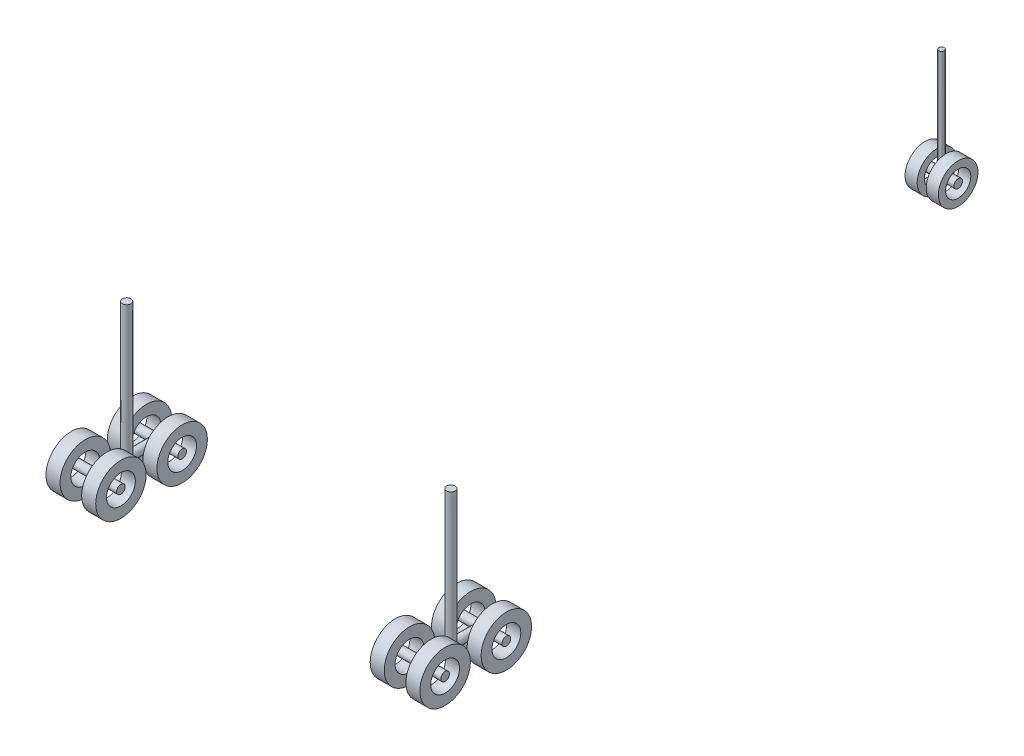
from build123d import *

# Parameters (mm, degrees)
SKETCH16_R               = 711.1999999999995
SKETCH16_R_2             = 406.3999999999997
BOSS_EXTRUDE1_DEPTH      = 396.24
BOSS_EXTRUDE1_2_DEPTH    = 396.24
SKETCH12_R               = 121.92000000000056
BOSS_EXTRUDE2_DEPTH      = 3810.0000000000005
SKETCH17_R               = 121.92000000000046
BOSS_EXTRUDE3_DEPTH      = 1402.08
SKETCH17_R_2             = 121.92000000000138
BOSS_EXTRUDE3_2_DEPTH    = 1402.08
BOSS_EXTRUDE4_DEPTH      = 762.0000000000001
BOSS_EXTRUDE4_DEPTH_BACK = 762.0000000000001
SKETCH18_R               = 121.92000000000046
SKETCH19_R               = 558.8000000000001
SKETCH19_R_2             = 355.60000000000025
BOSS_EXTRUDE5_DEPTH      = 342.9
SKETCH20_R               = 121.92000000000138
BOSS_EXTRUDE6_DEPTH      = 939.8
SKETCH21_R               = 76.20000000000083
BOSS_EXTRUDE7_DEPTH      = 3048.0000000000005


with BuildPart() as part:
    # Sketch16 → Boss-Extrude1 (new body)
    with BuildSketch(Plane(origin=(-4876.8, 0, 0), x_dir=(0, 0, -1), z_dir=(1, 0, 0))):
        with Locations((-6591.13578743189, -1.866e-14)):
            Circle(SKETCH16_R)
        with Locations((-6591.13578743189, -1.866e-14)):
            Circle(SKETCH16_R_2, mode=Mode.SUBTRACT)
    extrude(amount=-BOSS_EXTRUDE1_DEPTH)


with BuildPart() as body_2:
    # Sketch16 → Boss-Extrude1 2 (new body)
    with BuildSketch(Plane(origin=(-4876.8, 0, 0), x_dir=(0, 0, -1), z_dir=(1, 0, 0))):
        with Locations(Location((-8318.33578743189, -1.866e-14, 0), (0, 0, 180))):
            Circle(SKETCH16_R)
        with Locations(Location((-8318.33578743189, -1.866e-14, 0), (0, 0, 180))):
            Circle(SKETCH16_R_2, mode=Mode.SUBTRACT)
    extrude(amount=-BOSS_EXTRUDE1_2_DEPTH)


with BuildPart() as body_3:
    # Mirror2: mirrored copy
    add(part.part.mirror(Plane(origin=(-4572, 0, 0), x_dir=(0, 0, 1), z_dir=(1, 0, 0))))


with BuildPart() as body_4:
    # Mirror2 2: mirrored copy
    add(body_2.part.mirror(Plane(origin=(-4572, 0, 0), x_dir=(0, 0, 1), z_dir=(1, 0, 0))))


with BuildPart() as body_5:
    # Sketch12 → Boss-Extrude2 (new body)
    with BuildSketch(Plane(origin=(0, 0, 0), x_dir=(1, 0, 0), z_dir=(0, 1, 0))):
        with Locations(Location((-4572, -7454.73578743189, 0), (0, 0, 90))):
            Circle(SKETCH12_R)
    extrude(amount=BOSS_EXTRUDE2_DEPTH)



with BuildPart() as body_6:
    # Sketch17 → Boss-Extrude3 (new body)
    with BuildSketch(Plane.ZY.offset(5273.04)):
        with Locations((6591.13578743189, -1.866e-14)):
            Circle(SKETCH17_R)
    extrude(amount=-BOSS_EXTRUDE3_DEPTH)


with BuildPart() as body_7:
    # Sketch17 → Boss-Extrude3 2 (new body)
    with BuildSketch(Plane.ZY.offset(5273.04)):
        with Locations((8318.33578743189, -1.866e-14)):
            Circle(SKETCH17_R_2)
    extrude(amount=-BOSS_EXTRUDE3_2_DEPTH)


with BuildPart() as body_5_1:
    add(body_5.part)

    add(body_6.part)  # Boss-Extrude4 merges body 6

    add(body_7.part)  # Boss-Extrude4 merges body 7
    # Sketch18 → Boss-Extrude4 (add, two sides: drawn at the far end of the back side and taken through both)
    with BuildSketch(Plane.XY.offset(7454.735787431891).offset(-BOSS_EXTRUDE4_DEPTH_BACK)):
        with Locations(Location((-4572, 0, 0), (0, 0, 326.442690238))):
            Circle(SKETCH18_R)
    extrude(amount=BOSS_EXTRUDE4_DEPTH + BOSS_EXTRUDE4_DEPTH_BACK)


with BuildPart() as body_6_2:
    # Sketch19 → Boss-Extrude5 (new body)
    with BuildSketch(Plane(origin=(-126.99999999999945, 0, 0), x_dir=(0, 0, -1), z_dir=(1, 0, 0))):
        with Locations((10955.184212568114, -2.141e-14)):
            Circle(SKETCH19_R)
        with Locations((10955.184212568114, -2.141e-14)):
            Circle(SKETCH19_R_2, mode=Mode.SUBTRACT)
    extrude(amount=-BOSS_EXTRUDE5_DEPTH)


with BuildPart() as body_7_2:
    # Mirror4: mirrored copy
    add(body_6_2.part.mirror(Plane(origin=(0, 0, 0), x_dir=(0, 0, 1), z_dir=(1, 0, 0))))


with BuildPart() as body_8:
    # Mirror4 2: mirrored copy
    add(body_2.part.mirror(Plane(origin=(0, 0, 0), x_dir=(0, 0, 1), z_dir=(1, 0, 0))))


with BuildPart() as body_9:
    # Mirror4 3: mirrored copy
    add(part.part.mirror(Plane(origin=(0, 0, 0), x_dir=(0, 0, 1), z_dir=(1, 0, 0))))


with BuildPart() as body_10:
    # Mirror4 4: mirrored copy
    add(body_4.part.mirror(Plane(origin=(0, 0, 0), x_dir=(0, 0, 1), z_dir=(1, 0, 0))))


with BuildPart() as body_11:
    # Mirror4 5: mirrored copy
    add(body_5_1.part.mirror(Plane(origin=(0, 0, 0), x_dir=(0, 0, 1), z_dir=(1, 0, 0))))


with BuildPart() as body_12:
    # Mirror4 6: mirrored copy
    add(body_3.part.mirror(Plane(origin=(0, 0, 0), x_dir=(0, 0, 1), z_dir=(1, 0, 0))))


with BuildPart() as body_13:
    # Sketch20 → Boss-Extrude6 (new body)
    with BuildSketch(Plane.ZY.offset(469.8999999999994)):
        with Locations((-10955.184212568114, -2.141e-14)):
            Circle(SKETCH20_R)
    extrude(amount=-BOSS_EXTRUDE6_DEPTH)

    # Sketch21 → Boss-Extrude7 (add)
    with BuildSketch(Plane(origin=(0, 0, 0), x_dir=(1, 0, 0), z_dir=(0, 1, 0))):
        with Locations(Location((7.3161e-13, 10955.184212568114, 0), (0, 0, 90))):
            Circle(SKETCH21_R)
    extrude(amount=BOSS_EXTRUDE7_DEPTH)


solid = Compound([part.part, body_2.part, body_3.part, body_4.part, body_5_1.part, body_6_2.part, body_7_2.part, body_8.part, body_9.part, body_10.part, body_11.part, body_12.part, body_13.part])
